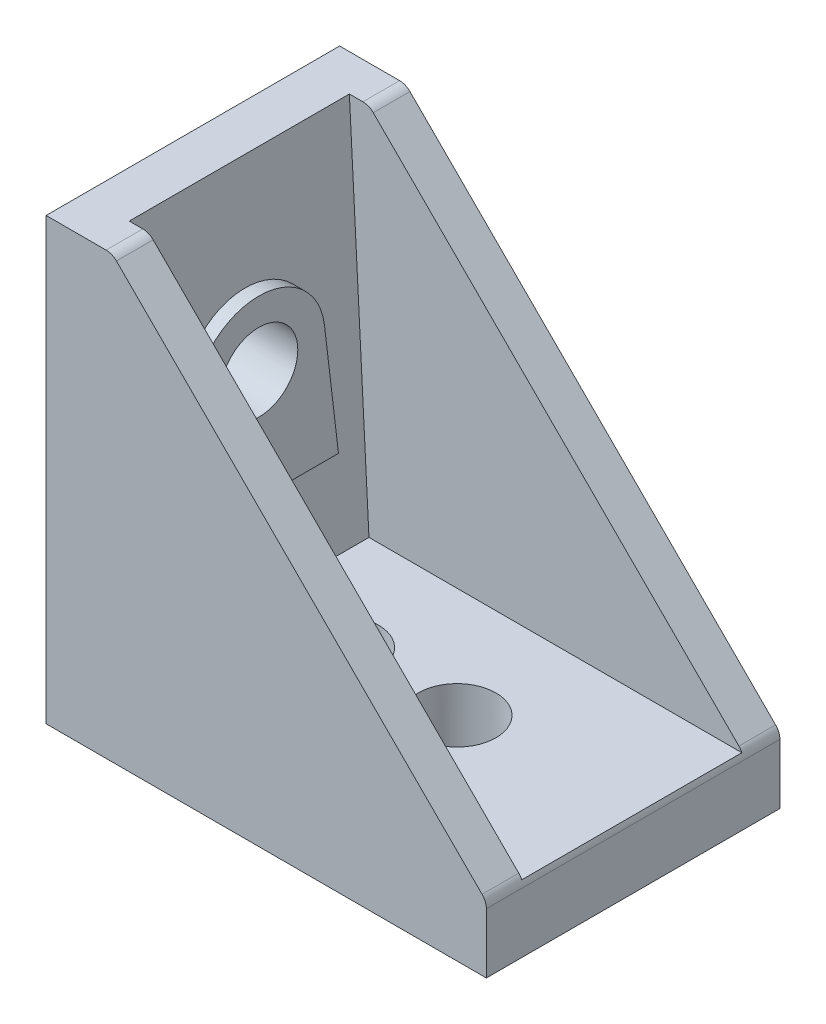
from build123d import *

# Parameters (mm, degrees)
SKETCH1_W               = 30
SKETCH1_H               = 30
BOSS_EXTRUDE1_DEPTH     = 10
CUT_EXTRUDE3_DEPTH      = 10
CUT_EXTRUDE3_DEPTH_BACK = 10
SKETCH7_OUTSIDE_W       = 41.38
SKETCH7_OUTSIDE_H       = 41.38
CUT_EXTRUDE4_DEPTH      = 7.5
BOSS_EXTRUDE3_REACH     = 50.089
BOSS_EXTRUDE3_START     = 4.5
DIAMETER_HOLE1_D        = 5.3
BOSS_EXTRUDE4_DEPTH     = 1
BOSS_EXTRUDE5_DEPTH     = 1
DIAMETER_HOLE2_D        = 5.3
DIAMETER_HOLE3_D        = 5.3


with BuildPart() as part:
    # Sketch1 → Boss-Extrude1 (new, symmetric)
    with BuildSketch(Plane.XY):
        with Locations((15, 15)):
            Rectangle(SKETCH1_W, SKETCH1_H)
    extrude(amount=BOSS_EXTRUDE1_DEPTH, both=True)

    # Sketch7 outside → Cut-Extrude3 (cut, two sides: drawn at the far end of the back side and taken through both)
    with BuildSketch(Plane.XY.offset(-CUT_EXTRUDE3_DEPTH_BACK)):
        with Locations((15, 15)):
            Rectangle(SKETCH7_OUTSIDE_W, SKETCH7_OUTSIDE_H)
        with BuildLine():
            Line((0, 0), (30, 0))
            Line((30, 0), (30, 4.085786438))
            ThreePointArc((30, 4.085786438), (29.923879533, 4.46846987), (29.707106781, 4.792893219))
            Line((29.707106781, 4.792893219), (4.792893219, 29.707106781))
            ThreePointArc((4.792893219, 29.707106781), (4.46846987, 29.923879533), (4.085786438, 30))
            Line((4.085786438, 30), (0, 30))
            Line((0, 30), (0, 0))
        make_face(mode=Mode.SUBTRACT)
    extrude(amount=CUT_EXTRUDE3_DEPTH + CUT_EXTRUDE3_DEPTH_BACK, mode=Mode.SUBTRACT)

    # Sketch8 → Cut-Extrude4 (cut, symmetric)
    with BuildSketch(Plane.XY):
        Polygon((3.163601628, 30), (4.5, 4.5), (30, 4.5), (30, 30), align=None)
    extrude(amount=CUT_EXTRUDE4_DEPTH, both=True, mode=Mode.SUBTRACT)

    # Boss-Extrude3: up to this plane
    boss_extrude3_end = Plane(origin=(3.163601628, 30, -7.5), z_dir=(-0.9986295347545743, -0.05233595624293714, 0))
    # Sketch9 → Boss-Extrude3 (add, up to the surface)
    with BuildSketch(Plane(origin=(0, 0, 0), x_dir=(0, 0, -1), z_dir=(1, 0, 0)).offset(BOSS_EXTRUDE3_START), mode=Mode.PRIVATE) as boss_extrude3_sk1:
        with BuildLine():
            Line((4.468669433, 18.530088202), (5.421224791, 10.5))
            Line((5.421224791, 10.5), (-5.421224791, 10.5))
            Line((-5.421224791, 10.5), (-4.468669433, 18.530088202))
            ThreePointArc((-4.468669433, 18.530088202), (0, 22.5), (4.468669433, 18.530088202))
        make_face()
    boss_extrude3_tool1 = split(extrude(boss_extrude3_sk1.sketch, amount=-BOSS_EXTRUDE3_REACH, mode=Mode.PRIVATE), bisect_by=boss_extrude3_end, keep=Keep.BOTH, mode=Mode.PRIVATE)
    add(boss_extrude3_tool1.solids().sort_by_distance((4.5, 15.863056, 0))[0])

    # Diameter Hole1 (through all)
    with Locations(Plane(origin=(0, 30, 0), x_dir=(1, 0, 0), z_dir=(0, 1, 0))):
        with Locations((18, 0)):
            Hole(DIAMETER_HOLE1_D / 2)

    # Sketch12 → Boss-Extrude4 (add)
    with BuildSketch(Plane(origin=(0, 0, 0), x_dir=(0, 0, -1), z_dir=(1, 0, 0))):
        with BuildLine():
            Line((2.7, 24), (-2.7, 24))
            ThreePointArc((-2.7, 24), (-2.912132034, 23.912132034), (-3, 23.7))
            Line((-3, 23.7), (-3, 21.3))
            ThreePointArc((-3, 21.3), (-2.912132034, 21.087867966), (-2.7, 21))
            Line((-2.7, 21), (2.7, 21))
            ThreePointArc((2.7, 21), (2.912132034, 21.087867966), (3, 21.3))
            Line((3, 21.3), (3, 23.7))
            ThreePointArc((3, 23.7), (2.912132034, 23.912132034), (2.7, 24))
        make_face()
        with BuildLine():
            Line((2.7, 11), (-2.7, 11))
            ThreePointArc((-2.7, 11), (-2.912132034, 10.912132034), (-3, 10.7))
            Line((-3, 10.7), (-3, 5.3))
            ThreePointArc((-3, 5.3), (-2.912132034, 5.087867966), (-2.7, 5))
            Line((-2.7, 5), (2.7, 5))
            ThreePointArc((2.7, 5), (2.912132034, 5.087867966), (3, 5.3))
            Line((3, 5.3), (3, 10.7))
            ThreePointArc((3, 10.7), (2.912132034, 10.912132034), (2.7, 11))
        make_face()
    extrude(amount=-BOSS_EXTRUDE4_DEPTH)

    # Sketch13 → Boss-Extrude5 (add)
    with BuildSketch(Plane(origin=(0, 0, 0), x_dir=(1, 0, 0), z_dir=(0, 1, 0))):
        with BuildLine():
            Line((10.5, -3), (12.7, -3))
            ThreePointArc((12.7, -3), (12.912132034, -2.912132034), (13, -2.7))
            Line((13, -2.7), (13, -0.5))
            Line((13, -0.5), (10.5, -0.5))
            Line((10.5, -0.5), (10.5, -3))
        make_face()
        with BuildLine():
            Line((7.3, -3), (9.5, -3))
            Line((9.5, -3), (9.5, -0.5))
            Line((9.5, -0.5), (7, -0.5))
            Line((7, -0.5), (7, -2.7))
            ThreePointArc((7, -2.7), (7.087867966, -2.912132034), (7.3, -3))
        make_face()
        with BuildLine():
            Line((7.3, 3), (9.5, 3))
            Line((9.5, 3), (9.5, 0.5))
            Line((9.5, 0.5), (7, 0.5))
            Line((7, 0.5), (7, 2.7))
            ThreePointArc((7, 2.7), (7.087867966, 2.912132034), (7.3, 3))
        make_face()
        with BuildLine():
            Line((10.5, 3), (12.7, 3))
            ThreePointArc((12.7, 3), (12.912132034, 2.912132034), (13, 2.7))
            Line((13, 2.7), (13, 0.5))
            Line((13, 0.5), (10.5, 0.5))
            Line((10.5, 0.5), (10.5, 3))
        make_face()
    extrude(amount=-BOSS_EXTRUDE5_DEPTH)

    # Diameter Hole2 (through all)
    with Locations(Plane(origin=(30, 10, 0), x_dir=(0, 1, 0), z_dir=(1, 0, 0))):
        with Locations((8, 0)):
            Hole(DIAMETER_HOLE2_D / 2)

    # Diameter Hole3 (through all)
    with Locations(Plane(origin=(0, 30, 0), x_dir=(1, 0, 0), z_dir=(0, 1, 0))):
        with Locations((10, 0)):
            Hole(DIAMETER_HOLE3_D / 2)


solid = part.part
